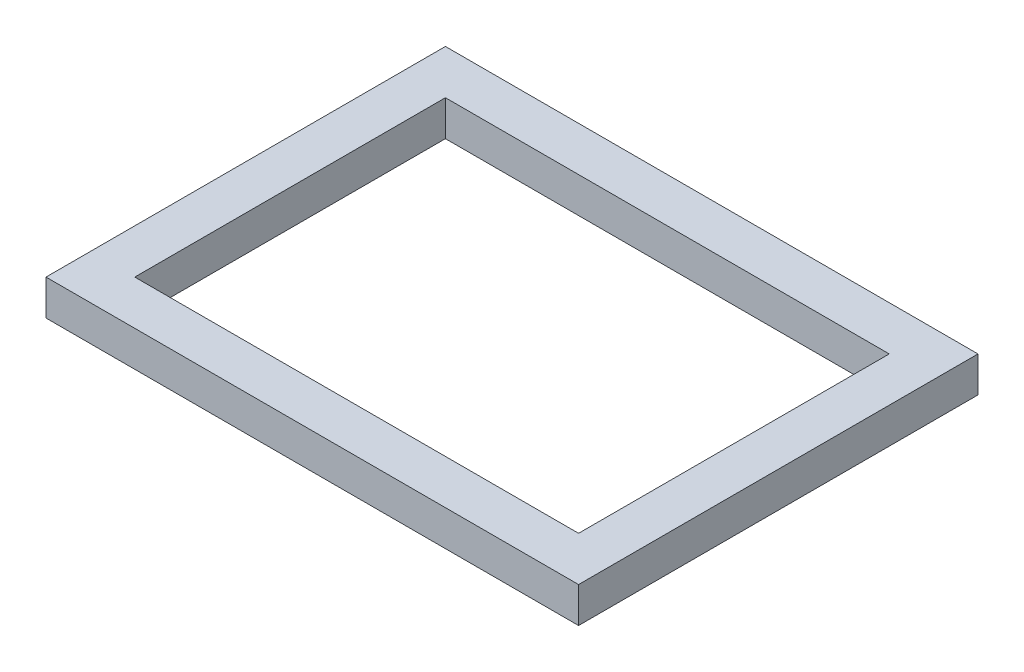
from build123d import *

# Parameters (mm, degrees)
SKETCH1_W           = 38.1
SKETCH1_H           = 28.575
SKETCH1_W_2         = 31.75
SKETCH1_H_2         = 22.225
BOSS_EXTRUDE1_DEPTH = 2.54


with BuildPart() as part:
    # Sketch1 → Boss-Extrude1 (new body)
    with BuildSketch(Plane(origin=(0, 0, 0), x_dir=(1, 0, 0), z_dir=(0, 1, 0))):
        Rectangle(SKETCH1_W, SKETCH1_H)
        Rectangle(SKETCH1_W_2, SKETCH1_H_2, mode=Mode.SUBTRACT)
    extrude(amount=BOSS_EXTRUDE1_DEPTH)


solid = part.part
